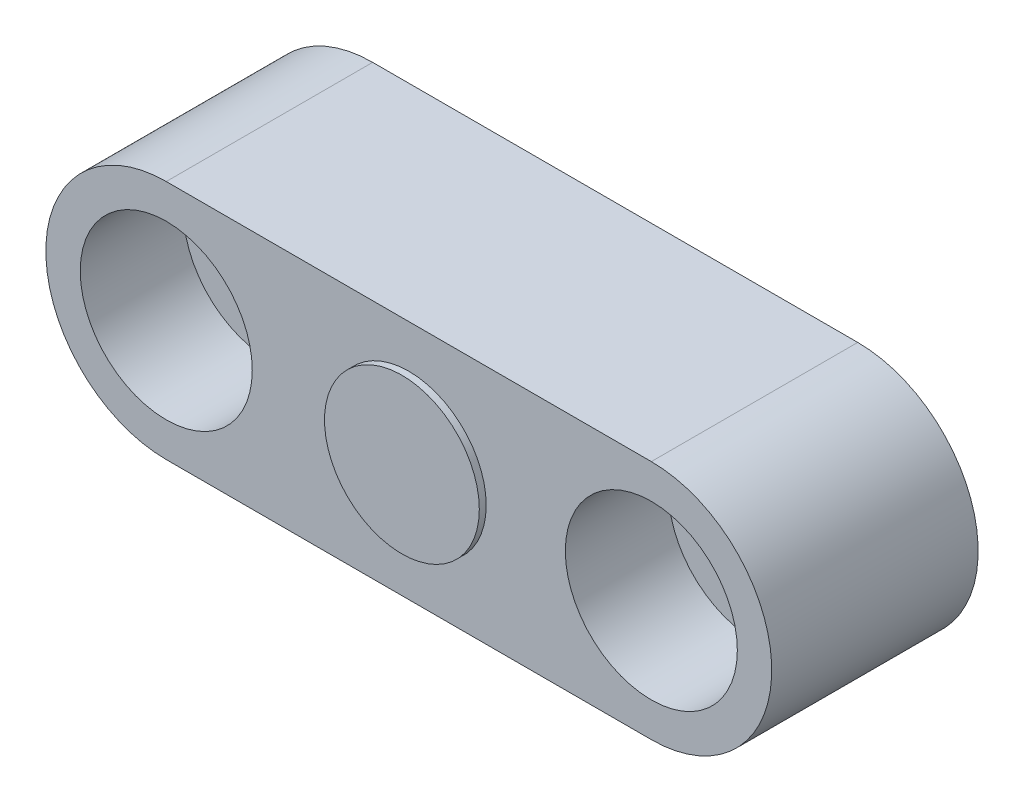
from build123d import *

# Parameters (mm, degrees)
ESTRUSIONE_ESTRUSIONE1_DEPTH      = 6
SCHIZZO2_R                        = 2.5
TAGLIO_ESTRUSIONE1_DEPTH          = 3
SCHIZZO3_R                        = 1.75
TAGLIO_ESTRUSIONE2_DEPTH          = 12.513144662
TAGLIO_ESTRUSIONE3_START          = -2
SCHIZZO4_R                        = 2.5
SCHIZZO4_R_2                      = 1.75
TAGLIO_ESTRUSIONE3_DEPTH          = 2
TAGLIO_ESTRUSIONE4_DEPTH          = 5
ESTRUSIONE_ESTRUSIONE2_DEPTH      = 0.2
ESTRUSIONE_ESTRUSIONE2_DEPTH_BACK = 1.2
SCHIZZO5_R                        = 2.25


with BuildPart() as part:
    # Schizzo1 → Estrusione-Estrusione1 (new body)
    with BuildSketch(Plane.XY):
        with BuildLine():
            Line((7.05, -3.5), (-7.05, -3.5))
            ThreePointArc((-7.05, -3.5), (-10.55, 0), (-7.05, 3.5))
            Line((-7.05, 3.5), (7.05, 3.5))
            ThreePointArc((7.05, 3.5), (10.55, 0), (7.05, -3.5))
        make_face()
    extrude(amount=ESTRUSIONE_ESTRUSIONE1_DEPTH)

    # Schizzo2 → Taglio-Estrusione1 (cut)
    with BuildSketch(Plane.XY.offset(6)):
        with Locations((7.05, 0)):
            Circle(SCHIZZO2_R)
    taglio_estrusione1 = extrude(amount=-TAGLIO_ESTRUSIONE1_DEPTH, mode=Mode.SUBTRACT)

    # Schizzo3 → Taglio-Estrusione2 (cut, through all)
    with BuildSketch(Plane.XY.offset(3)):
        with Locations((7.05, 0)):
            Circle(SCHIZZO3_R)
    taglio_estrusione2 = extrude(amount=-TAGLIO_ESTRUSIONE2_DEPTH, mode=Mode.SUBTRACT)

    # Schizzo4 → Taglio-Estrusione3 (cut)
    with BuildSketch(Plane(origin=(0, 0, 0), x_dir=(-1, 0, 0), z_dir=(0, 0, -1)).offset(TAGLIO_ESTRUSIONE3_START)):
        with Locations(Location((-7.05, 0, 0), (0, 0, 180))):
            Circle(SCHIZZO4_R)
        with Locations(Location((-7.05, 0, 0), (0, 0, 180))):
            Circle(SCHIZZO4_R_2, mode=Mode.SUBTRACT)
    taglio_estrusione3 = extrude(amount=TAGLIO_ESTRUSIONE3_DEPTH, mode=Mode.SUBTRACT)

    # Specchia1: Taglio-Estrusione1, Taglio-Estrusione2, Taglio-Estrusione3 across plane
    add(taglio_estrusione1.mirror(Plane(origin=(0, 0, 0), x_dir=(0, 0, 1), z_dir=(1, 0, 0))), mode=Mode.SUBTRACT)
    add(taglio_estrusione2.mirror(Plane(origin=(0, 0, 0), x_dir=(0, 0, 1), z_dir=(1, 0, 0))), mode=Mode.SUBTRACT)
    add(taglio_estrusione3.mirror(Plane(origin=(0, 0, 0), x_dir=(0, 0, 1), z_dir=(1, 0, 0))), mode=Mode.SUBTRACT)

    # Schizzo6 → Taglio-Estrusione4 (cut)
    with BuildSketch(Plane(origin=(0, 0, 0), x_dir=(-1, 0, 0), z_dir=(0, 0, -1))):
        with BuildLine():
            Line((-5.457945829, 2.75), (5.457945829, 2.75))
            ThreePointArc((5.457945829, 2.75), (3.87240083, 0), (5.457945829, -2.75))
            Line((5.457945829, -2.75), (-5.457945829, -2.75))
            ThreePointArc((-5.457945829, -2.75), (-3.87240083, 0), (-5.457945829, 2.75))
        make_face()
    extrude(amount=-TAGLIO_ESTRUSIONE4_DEPTH, mode=Mode.SUBTRACT)

    # Schizzo5 → Estrusione-Estrusione2 (add, two sides: drawn at the far end of the back side and taken through both)
    with BuildSketch(Plane.XY.offset(6).offset(-ESTRUSIONE_ESTRUSIONE2_DEPTH_BACK)):
        Circle(SCHIZZO5_R)
    extrude(amount=ESTRUSIONE_ESTRUSIONE2_DEPTH + ESTRUSIONE_ESTRUSIONE2_DEPTH_BACK)


solid = part.part
